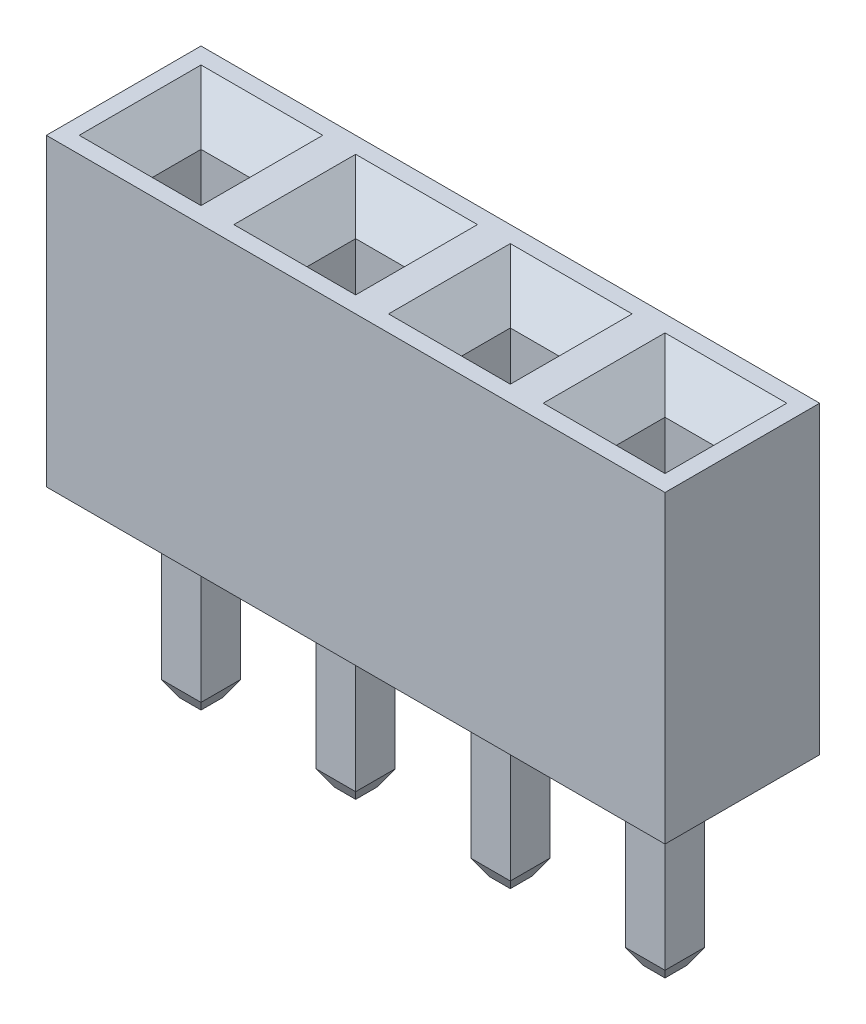
from build123d import *

# Parameters (mm, degrees)
SKETCH1_W                   = 2.54
SKETCH1_H                   = 2.54
BOSS_EXTRUDE1_DEPTH         = 5
SKETCH2_W                   = 0.65
SKETCH2_H                   = 0.65
BOSS_EXTRUDE2_DEPTH         = 3
CHAMFER1_SIZE               = 0.15
CHAMFER1_SIZE2              = 0.259807621
SKETCH3_W                   = 0.8
SKETCH3_H                   = 0.8
CUT_EXTRUDE1_DEPTH          = 3
CHAMFER2_SIZE               = 0.6
LPATTERN1_COUNT             = 4
LPATTERN1_PITCH             = 2.54
CHAMFER1_OF_LPATTERN1_SIZE2 = 0.15
CHAMFER1_OF_LPATTERN1_SIZE  = 0.259807621
CHAMFER2_OF_LPATTERN1_SIZE  = 0.6


with BuildPart() as part:
    # Sketch1 → Boss-Extrude1 (new body)
    with BuildSketch(Plane(origin=(0, 0, 0), x_dir=(1, 0, 0), z_dir=(0, 1, 0))):
        Rectangle(SKETCH1_W, SKETCH1_H)
    boss_extrude1 = extrude(amount=BOSS_EXTRUDE1_DEPTH)

    # Sketch2 → Boss-Extrude2 (add)
    with BuildSketch(Plane.XZ):
        Rectangle(SKETCH2_W, SKETCH2_H)
    boss_extrude2 = extrude(amount=BOSS_EXTRUDE2_DEPTH)

    # Chamfer1
    chamfer1_edges = [part.edges().sort_by_distance(p)[0] for p in [
        (0.325, -3, 0),
        (0, -3, 0.325),
        (-0.325, -3, 0),
        (0, -3, -0.325),
    ]]
    chamfer1_side = [part.faces().sort_by_distance(p)[0] for p in [
        (0, -3, 0),
    ]]
    chamfer(chamfer1_edges, length=CHAMFER1_SIZE, length2=CHAMFER1_SIZE2, reference=chamfer1_side[0])

    # Sketch3 → Cut-Extrude1 (cut)
    with BuildSketch(Plane(origin=(0, 5, 0), x_dir=(1, 0, 0), z_dir=(0, 1, 0))):
        Rectangle(SKETCH3_W, SKETCH3_H)
    cut_extrude1 = extrude(amount=-CUT_EXTRUDE1_DEPTH, mode=Mode.SUBTRACT)

    # Chamfer2
    chamfer2_edges = [part.edges().sort_by_distance(p)[0] for p in [
        (0.4, 5, 0),
        (0, 5, -0.4),
        (-0.4, 5, 0),
        (0, 5, 0.4),
    ]]
    chamfer(chamfer2_edges, length=CHAMFER2_SIZE)

    # LPattern1: Boss-Extrude1, Boss-Extrude2, Cut-Extrude1 ×4
    with Locations(*[(i * LPATTERN1_PITCH, 0, 0) for i in range(1, LPATTERN1_COUNT)]):
        add(boss_extrude1)
        add(boss_extrude2)
        add(cut_extrude1, mode=Mode.SUBTRACT)

    # Chamfer1 of LPattern1
    chamfer1_of_lpattern1_edges = [part.edges().sort_by_distance(p)[0] for p in [
        (2.865, -3, 0),
        (2.54, -3, 0.325),
        (2.215, -3, 0),
        (2.54, -3, -0.325),
        (5.405, -3, 0),
        (5.08, -3, 0.325),
        (4.755, -3, 0),
        (5.08, -3, -0.325),
        (7.945, -3, 0),
        (7.62, -3, 0.325),
        (7.295, -3, 0),
        (7.62, -3, -0.325),
    ]]
    chamfer(chamfer1_of_lpattern1_edges, length=CHAMFER1_OF_LPATTERN1_SIZE, length2=CHAMFER1_OF_LPATTERN1_SIZE2)

    # Chamfer2 of LPattern1
    chamfer2_of_lpattern1_edges = [part.edges().sort_by_distance(p)[0] for p in [
        (2.94, 5, 0),
        (2.54, 5, -0.4),
        (2.14, 5, 0),
        (2.54, 5, 0.4),
        (5.48, 5, 0),
        (5.08, 5, -0.4),
        (4.68, 5, 0),
        (5.08, 5, 0.4),
        (8.02, 5, 0),
        (7.62, 5, -0.4),
        (7.22, 5, 0),
        (7.62, 5, 0.4),
    ]]
    chamfer(chamfer2_of_lpattern1_edges, length=CHAMFER2_OF_LPATTERN1_SIZE)


solid = part.part
